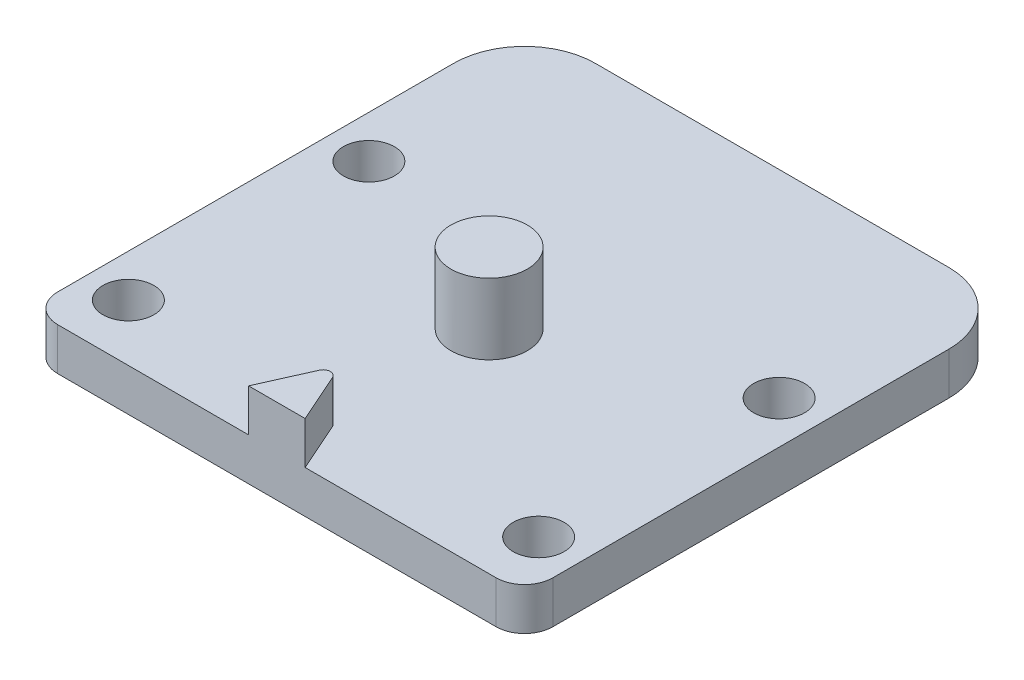
from build123d import *

# Parameters (mm, degrees)
SKETCH1_W               = 35
SKETCH1_H               = 35
BOSS_EXTRUDE1_DEPTH     = 3
SKETCH3_R               = 1.8
CUT_EXTRUDE2_DEPTH      = 3
MIRROR2_COPY_1_SKETCH_R = 1.8
MIRROR2_COPY_1_DEPTH    = 3
SKETCH2_R               = 2.7
BOSS_EXTRUDE2_DEPTH     = 5
BOSS_EXTRUDE3_DEPTH     = 3
FILLET2_R               = 0.5
FILLET3_R               = 2
FILLET4_R               = 5


with BuildPart() as part:
    # Sketch1 → Boss-Extrude1 (new body)
    with BuildSketch(Plane(origin=(0, 0, 0), x_dir=(1, 0, 0), z_dir=(0, 1, 0))):
        with Locations((17.5, 17.5)):
            Rectangle(SKETCH1_W, SKETCH1_H)
    extrude(amount=BOSS_EXTRUDE1_DEPTH)

    # Sketch3 → Cut-Extrude2 (cut)
    with BuildSketch(Plane(origin=(0, 3, 0), x_dir=(1, 0, 0), z_dir=(0, 1, 0))):
        with Locations(Location((3, 21, 0), (0, 0, 270))):
            Circle(SKETCH3_R)
    cut_extrude2 = extrude(amount=-CUT_EXTRUDE2_DEPTH, mode=Mode.SUBTRACT)

    # Mirror1: Cut-Extrude2 across plane
    add(cut_extrude2.mirror(Plane.XY.offset(-12.5)), mode=Mode.SUBTRACT)

    # Mirror2: Cut-Extrude2 across plane
    add(cut_extrude2.mirror(Plane(origin=(17.5, 0, 0), x_dir=(0, 0, 1), z_dir=(1, 0, 0))), mode=Mode.SUBTRACT)

    # Mirror2 copy 1 sketch → Mirror2 copy 1 (cut)
    with BuildSketch(Plane(origin=(35, 3, -25), x_dir=(-1, 0, 0), z_dir=(0, 1, 0))):
        with Locations(Location((3, 21, 0), (0, 0, 270))):
            Circle(MIRROR2_COPY_1_SKETCH_R)
    extrude(amount=-MIRROR2_COPY_1_DEPTH, mode=Mode.SUBTRACT)

    # Sketch2 → Boss-Extrude2 (add)
    with BuildSketch(Plane(origin=(0, 3, 0), x_dir=(1, 0, 0), z_dir=(0, 1, 0))):
        with Locations(Location((17.5, 15, 0), (0, 0, 90))):
            Circle(SKETCH2_R)
    extrude(amount=BOSS_EXTRUDE2_DEPTH)

    # Sketch5 → Boss-Extrude3 (add)
    with BuildSketch(Plane(origin=(0, 3, 0), x_dir=(1, 0, 0), z_dir=(0, 1, 0))):
        Polygon((17.5, 4.5), (15.5, 0), (19.5, 0), align=None)
    extrude(amount=BOSS_EXTRUDE3_DEPTH)

    # Fillet2
    fillet2_edges = [part.edges().sort_by_distance(p)[0] for p in [
        (17.5, 4.5, -4.5),
    ]]
    fillet(fillet2_edges, radius=FILLET2_R)

    # Fillet3
    fillet3_edges = [part.edges().sort_by_distance(p)[0] for p in [
        (35, 1.5, 0),
        (0, 1.5, 0),
    ]]
    fillet(fillet3_edges, radius=FILLET3_R)

    # Fillet4
    fillet4_edges = [part.edges().sort_by_distance(p)[0] for p in [
        (0, 1.5, -35),
        (35, 1.5, -35),
    ]]
    fillet(fillet4_edges, radius=FILLET4_R)


solid = part.part
